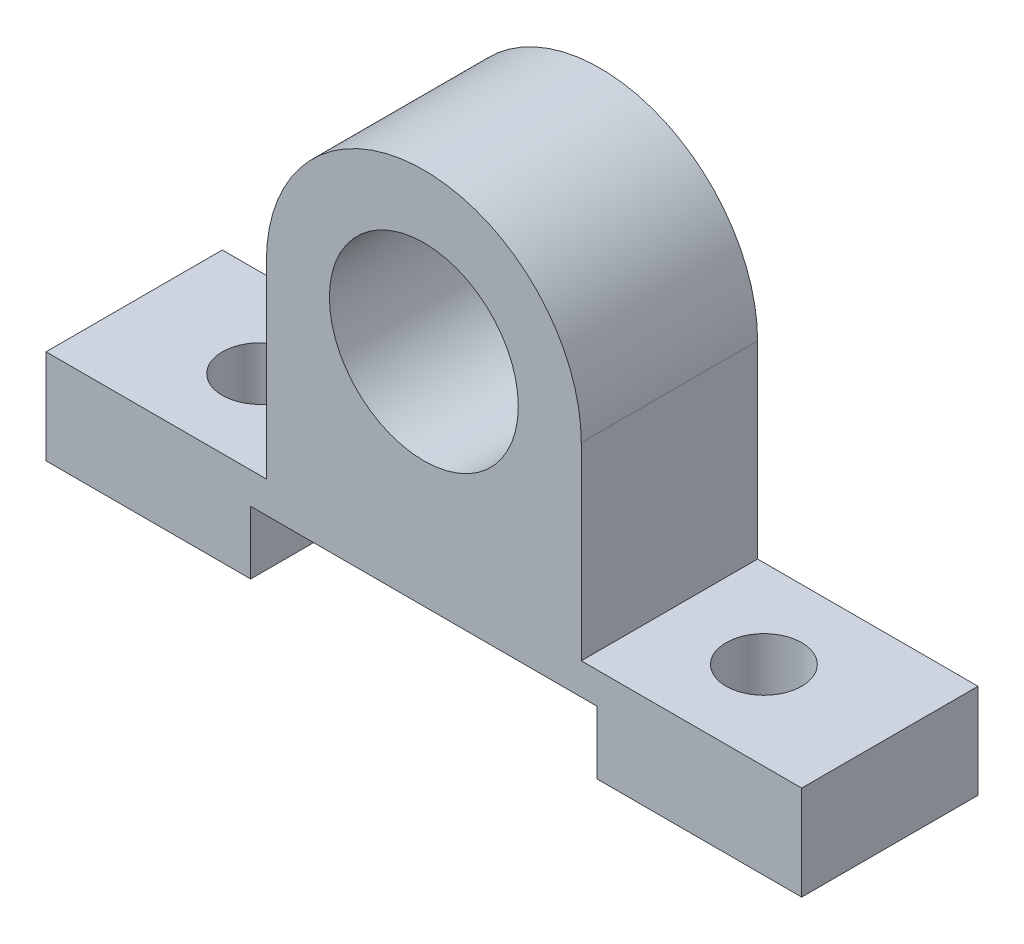
from build123d import *

# Parameters (mm, degrees)
SKETCH2_R           = 19.05
BOSS_EXTRUDE1_DEPTH = 17.78
SKETCH3_R           = 7.62
CUT_EXTRUDE1_DEPTH  = 105.888468861


with BuildPart() as part:
    # Sketch2 → Boss-Extrude1 (new, symmetric)
    with BuildSketch(Plane.XY):
        with BuildLine():
            Line((34.925, 0), (76.2, 0))
            Line((76.2, 0), (76.2, 19.05))
            Line((76.2, 19.05), (31.75, 19.05))
            Line((31.75, 19.05), (31.75, 57.15))
            ThreePointArc((31.75, 57.15), (0, 88.9), (-31.75, 57.15))
            Line((-31.75, 57.15), (-31.75, 19.05))
            Line((-31.75, 19.05), (-76.2, 19.05))
            Line((-76.2, 19.05), (-76.2, 0))
            Line((-76.2, 0), (-34.925, 0))
            Line((-34.925, 0), (-34.925, 12.7))
            Line((-34.925, 12.7), (34.925, 12.7))
            Line((34.925, 12.7), (34.925, 0))
        make_face()
        with Locations(Location((0, 57.15, 0), (0, 0, 180))):
            Circle(SKETCH2_R, mode=Mode.SUBTRACT)
    extrude(amount=BOSS_EXTRUDE1_DEPTH, both=True)

    # Sketch3 → Cut-Extrude1 (cut, through all)
    with BuildSketch(Plane(origin=(0, 19.05, 0), x_dir=(1, 0, 0), z_dir=(0, 1, 0))):
        with Locations(Location((-50.8, 0, 0), (0, 0, 180))):
            Circle(SKETCH3_R)
        with Locations(Location((50.8, 0, 0), (0, 0, 180))):
            Circle(SKETCH3_R)
    extrude(amount=-CUT_EXTRUDE1_DEPTH, mode=Mode.SUBTRACT)


solid = part.part
